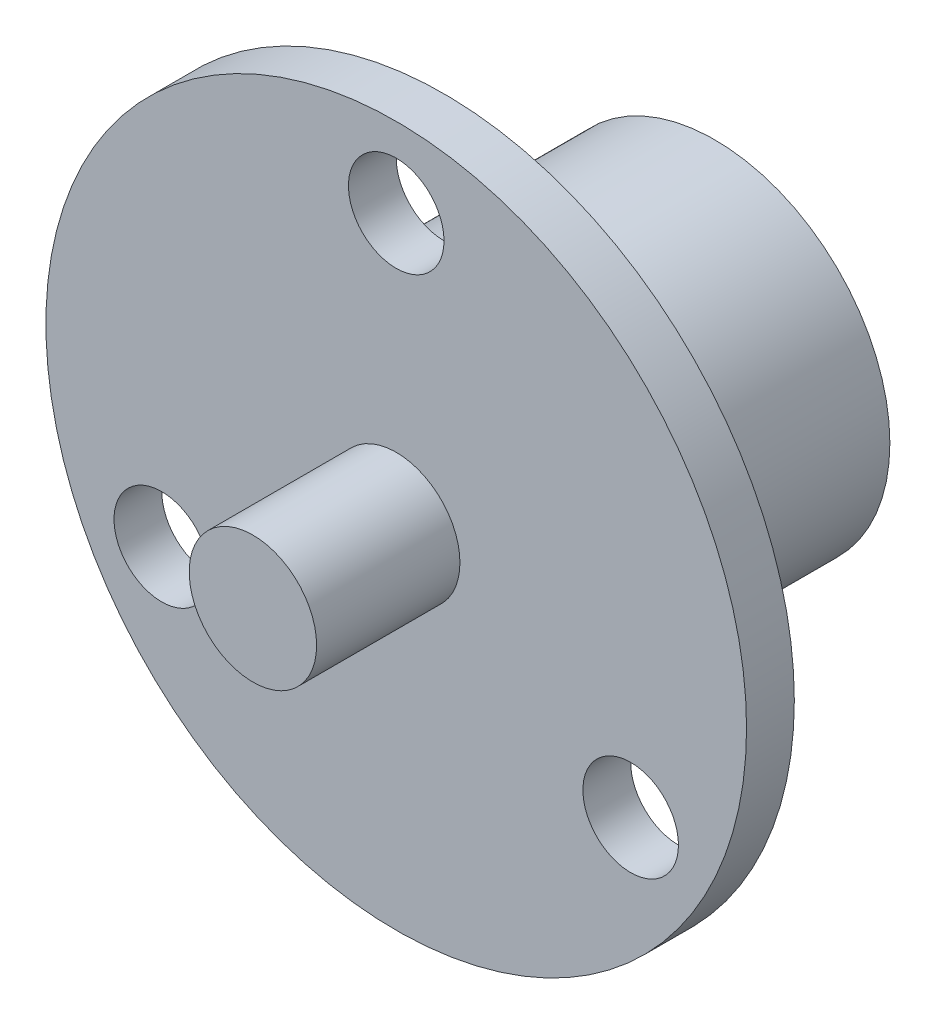
from build123d import *

# Parameters (mm, degrees)
ESQUISSE1_R             = 11
BOSS_EXTRU_1_DEPTH      = 17
ESQUISSE2_R             = 22
BOSS_EXTRU_2_DEPTH      = 3
ESQUISSE3_R             = 4
BOSS_EXTRU_3_DEPTH      = 9
ENL_V_MAT_EXTRU_1_REACH = 38.986
ESQUISSE5_R             = 3


with BuildPart() as part:
    # Esquisse1 → Boss.-Extru.1 (new body)
    with BuildSketch(Plane.XY):
        Circle(ESQUISSE1_R)
    extrude(amount=BOSS_EXTRU_1_DEPTH)

    # Esquisse2 → Boss.-Extru.2 (add)
    with BuildSketch(Plane.XY.offset(17)):
        Circle(ESQUISSE2_R)
    extrude(amount=BOSS_EXTRU_2_DEPTH)

    # Esquisse3 → Boss.-Extru.3 (add)
    with BuildSketch(Plane.XY.offset(20)):
        Circle(ESQUISSE3_R)
    extrude(amount=BOSS_EXTRU_3_DEPTH)

    # Esquisse5 → Enlèv. mat.-Extru.1 (cut, up to next)
    with BuildSketch(Plane.XY.offset(20), mode=Mode.PRIVATE) as enl_v_mat_extru_1_sk1:
        with Locations((0, 17)):
            Circle(ESQUISSE5_R)
    enl_v_mat_extru_1_tool1 = extrude(enl_v_mat_extru_1_sk1.sketch, amount=-ENL_V_MAT_EXTRU_1_REACH, mode=Mode.PRIVATE) & part.part
    # Esquisse5 → Enlèv. mat.-Extru.1 (cut, up to next)
    with BuildSketch(Plane.XY.offset(20), mode=Mode.PRIVATE) as enl_v_mat_extru_1_sk2:
        with Locations((14.722431864, -8.5)):
            Circle(ESQUISSE5_R)
    enl_v_mat_extru_1_tool2 = extrude(enl_v_mat_extru_1_sk2.sketch, amount=-ENL_V_MAT_EXTRU_1_REACH, mode=Mode.PRIVATE) & part.part
    # Esquisse5 → Enlèv. mat.-Extru.1 (cut, up to next)
    with BuildSketch(Plane.XY.offset(20), mode=Mode.PRIVATE) as enl_v_mat_extru_1_sk3:
        with Locations((-14.722431864, -8.5)):
            Circle(ESQUISSE5_R)
    enl_v_mat_extru_1_tool3 = extrude(enl_v_mat_extru_1_sk3.sketch, amount=-ENL_V_MAT_EXTRU_1_REACH, mode=Mode.PRIVATE) & part.part
    add(enl_v_mat_extru_1_tool1.solids().sort_by_distance((0, 17, 20))[0], mode=Mode.SUBTRACT)
    add(enl_v_mat_extru_1_tool2.solids().sort_by_distance((14.722432, -8.5, 20))[0], mode=Mode.SUBTRACT)
    add(enl_v_mat_extru_1_tool3.solids().sort_by_distance((-14.722432, -8.5, 20))[0], mode=Mode.SUBTRACT)


solid = part.part
